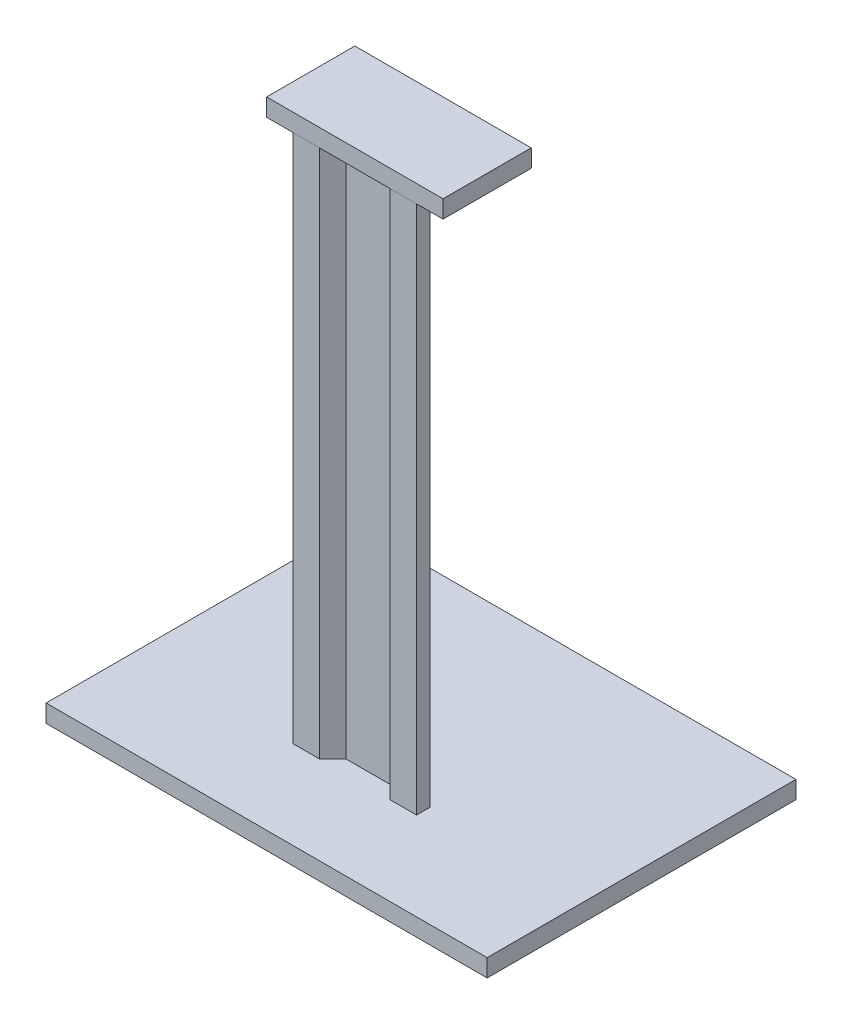
from build123d import *

# Parameters (mm, degrees)
SALIENTE_EXTRUIR1_DEPTH = 600
CROQUIS2_W              = 500
CROQUIS2_H              = 350
SALIENTE_EXTRUIR2_DEPTH = 20
CROQUIS3_W              = 3
CROQUIS3_H              = 600
CORTAR_EXTRUIR1_DEPTH   = 2
SALIENTE_EXTRUIR3_REACH = 715.723
CROQUIS4_R              = 15
CROQUIS6_W              = 200
CROQUIS6_H              = 100
SALIENTE_EXTRUIR5_DEPTH = 20


with BuildPart() as part:
    # Croquis1 → Saliente-Extruir1 (new body)
    with BuildSketch(Plane(origin=(0, 0, 0), x_dir=(1, 0, 0), z_dir=(0, 1, 0))):
        Polygon((25, 15), (-25, 15), (-40, 0), (-70, 0), (-70, 15), (-46.213203436, 15), (-10.606601718, 50.606601718), (0, 40), (10.606601718, 50.606601718), (46.213203436, 15), (70, 15), (70, 0), (40, 0), align=None)
    extrude(amount=SALIENTE_EXTRUIR1_DEPTH)

    # Croquis2 → Saliente-Extruir2 (add)
    with BuildSketch(Plane.XZ):
        with Locations((0, -75)):
            Rectangle(CROQUIS2_W, CROQUIS2_H)
    extrude(amount=SALIENTE_EXTRUIR2_DEPTH)

    # Croquis3 → Cortar-Extruir1 (cut)
    with BuildSketch(Plane(origin=(0, 0, -15), x_dir=(-1, 0, 0), z_dir=(0, 0, -1))):
        with Locations((58.106601718, 300)):
            Rectangle(CROQUIS3_W, CROQUIS3_H)
    cortar_extruir1 = extrude(amount=-CORTAR_EXTRUIR1_DEPTH, mode=Mode.SUBTRACT)

    # Simetría1: Cortar-Extruir1 across plane
    add(cortar_extruir1.mirror(Plane(origin=(0, 0, 0), x_dir=(0, 0, 1), z_dir=(1, 0, 0))), mode=Mode.SUBTRACT)


with BuildPart() as body_2:

    # Croquis4 → Saliente-Extruir3 (new, up to next)
    with BuildSketch(Plane(origin=(0, 600, 0), x_dir=(1, 0, 0), z_dir=(0, 1, 0)), mode=Mode.PRIVATE) as saliente_extruir3_sk1:
        with Locations(Location((0, 61.213203436, 0), (0, 0, 270))):
            Circle(CROQUIS4_R)
    saliente_extruir3_tool1 = extrude(saliente_extruir3_sk1.sketch, amount=-SALIENTE_EXTRUIR3_REACH, mode=Mode.PRIVATE) - part.part
    add(saliente_extruir3_tool1.solids().sort_by_distance((0, 600, -61.213203))[0])


with BuildPart() as body_3:
    # Croquis6 → Saliente-Extruir5 (new body)
    with BuildSketch(Plane(origin=(0, 600, 0), x_dir=(1, 0, 0), z_dir=(0, 1, 0))):
        with Locations((0, 50)):
            Rectangle(CROQUIS6_W, CROQUIS6_H)
    extrude(amount=SALIENTE_EXTRUIR5_DEPTH)


solid = Compound([part.part, body_2.part, body_3.part])
